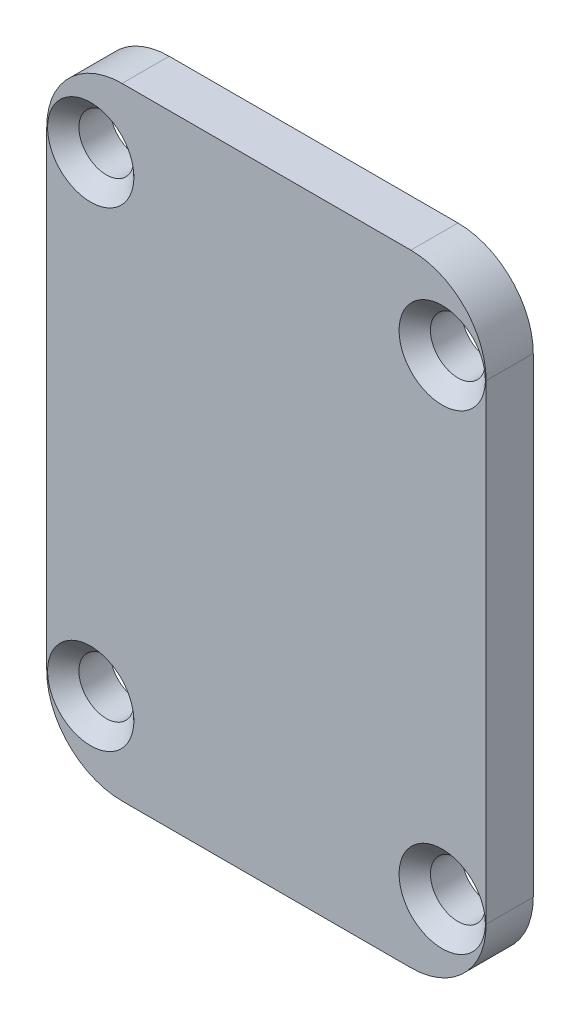
from build123d import *

# Parameters (mm, degrees)
SZKIC1_W                    = 28.4
SZKIC1_H                    = 40
DODANIE_WYCI_GNI_CIE1_DEPTH = 3
ZAOKR_GLENIE1_R             = 5
SZKIC2_R                    = 1.75
WYTNIJ_WYCI_GNI_CIE1_DEPTH  = 3
SFAZOWANIE1_SIZE            = 1
WYTNIJ_WYCI_GNI_CIE2_DEPTH  = 3


with BuildPart() as part:
    # Szkic1 → Dodanie-wyciągnięcie1 (new body)
    with BuildSketch(Plane.XY):
        Rectangle(SZKIC1_W, SZKIC1_H)
    extrude(amount=DODANIE_WYCI_GNI_CIE1_DEPTH)

    # Zaokrąglenie1
    zaokr_glenie1_edges = [part.edges().sort_by_distance(p)[0] for p in [
        (14.2, -20, 1.5),
        (-14.2, -20, 1.5),
        (-14.2, 20, 1.5),
        (14.2, 20, 1.5),
    ]]
    fillet(zaokr_glenie1_edges, radius=ZAOKR_GLENIE1_R)

    # Szkic2 → Wytnij-wyciągnięcie1 (cut)
    with BuildSketch(Plane.XY.offset(3)):
        with Locations((-11.2, 15)):
            Circle(SZKIC2_R)
        with Locations((11.2, 15)):
            Circle(SZKIC2_R)
        with Locations((-11.2, -15)):
            Circle(SZKIC2_R)
        with Locations((11.2, -15)):
            Circle(SZKIC2_R)
    extrude(amount=-WYTNIJ_WYCI_GNI_CIE1_DEPTH, mode=Mode.SUBTRACT)

    # Sfazowanie1
    sfazowanie1_edges = [part.edges().sort_by_distance(p)[0] for p in [
        (9.45, 15, 3),
        (-12.95, -15, 3),
        (9.45, -15, 3),
        (-12.95, 15, 3),
    ]]
    chamfer(sfazowanie1_edges, length=SFAZOWANIE1_SIZE)

    # Szkic3 → Wytnij-wyciągnięcie2 (cut)
    with BuildSketch(Plane.XY.offset(3)):
        with BuildLine():
            Line((-14.2, 15), (-14.2, -15))
            ThreePointArc((-14.2, -15), (-12.735533906, -18.535533906), (-9.2, -20))
            Line((-9.2, -20), (9.2, -20))
            ThreePointArc((9.2, -20), (12.735533906, -18.535533906), (14.2, -15))
            Line((14.2, -15), (14.2, 15))
            ThreePointArc((14.2, 15), (12.735533906, 18.535533906), (9.2, 20))
            Line((9.2, 20), (-9.2, 20))
            ThreePointArc((-9.2, 20), (-12.735533906, 18.535533906), (-14.2, 15))
        make_face()
        with BuildLine():
            Line((9.2, 19.8), (-9.2, 19.8))
            ThreePointArc((-9.2, 19.8), (-12.59411255, 18.39411255), (-14, 15))
            Line((-14, 15), (-14, -15))
            ThreePointArc((-14, -15), (-12.59411255, -18.39411255), (-9.2, -19.8))
            Line((-9.2, -19.8), (9.2, -19.8))
            ThreePointArc((9.2, -19.8), (12.59411255, -18.39411255), (14, -15))
            Line((14, -15), (14, 15))
            ThreePointArc((14, 15), (12.59411255, 18.39411255), (9.2, 19.8))
        make_face(mode=Mode.SUBTRACT)
    extrude(amount=-WYTNIJ_WYCI_GNI_CIE2_DEPTH, mode=Mode.SUBTRACT)


solid = part.part
